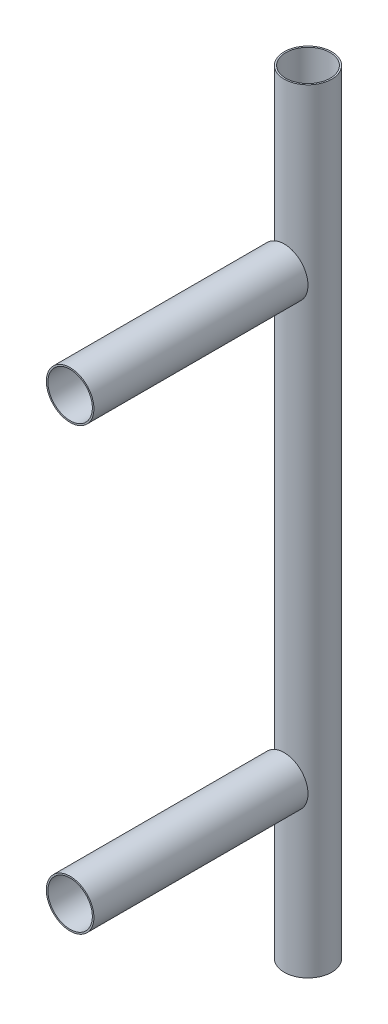
from build123d import *

# Parameters (mm, degrees)
SKETCH1_R             = 12.7
SKETCH1_R_2           = 11.8745
BOSS_EXTRUDE1_DEPTH   = 413.004
SKETCH2_R             = 12.7
SKETCH2_R_2           = 11.8745
BOSS_EXTRUDE2_DEPTH   = 114.3
BOSS_EXTRUDE2_2_DEPTH = 114.3


with BuildPart() as part:
    # Sketch1 → Boss-Extrude1 (new body)
    with BuildSketch(Plane(origin=(0, 0, 0), x_dir=(1, 0, 0), z_dir=(0, 1, 0))):
        with Locations(Location((0, 0, 0), (0, 0, 270))):
            Circle(SKETCH1_R)
        with Locations(Location((0, 0, 0), (0, 0, 270))):
            Circle(SKETCH1_R_2, mode=Mode.SUBTRACT)
    extrude(amount=BOSS_EXTRUDE1_DEPTH)


with BuildPart() as body_2:
    # Sketch2 → Boss-Extrude2 (new body)
    with BuildSketch(Plane.XY.offset(12.7)):
        with Locations((0, 324.104)):
            Circle(SKETCH2_R)
        with Locations((0, 324.104)):
            Circle(SKETCH2_R_2, mode=Mode.SUBTRACT)
    extrude(amount=BOSS_EXTRUDE2_DEPTH)


with BuildPart() as body_3:
    # Sketch2 → Boss-Extrude2 2 (new body)
    with BuildSketch(Plane.XY.offset(12.7)):
        with Locations((0, 88.9)):
            Circle(SKETCH2_R)
        with Locations((0, 88.9)):
            Circle(SKETCH2_R_2, mode=Mode.SUBTRACT)
    extrude(amount=BOSS_EXTRUDE2_2_DEPTH)


solid = Compound([part.part, body_2.part, body_3.part])
